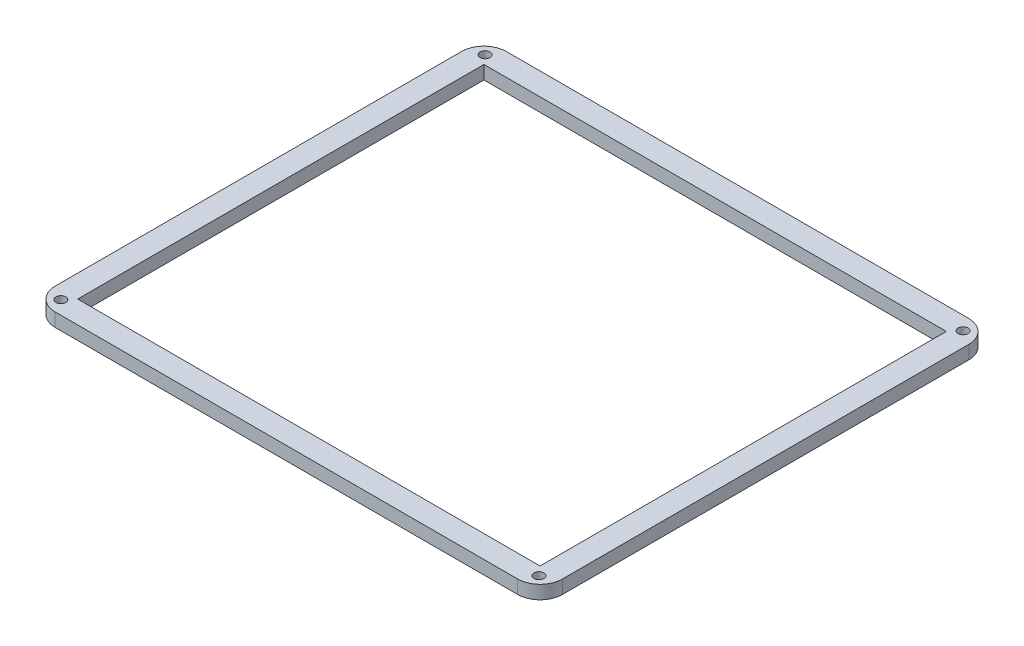
from build123d import *

# Parameters (mm, degrees)
SKETCH1_R           = 1.1
SKETCH1_W           = 103
SKETCH1_H           = 90.5
BOSS_EXTRUDE1_DEPTH = 3


with BuildPart() as part:
    # Sketch1 → Boss-Extrude1 (new body)
    with BuildSketch(Plane(origin=(0, 0, 0), x_dir=(1, 0, 0), z_dir=(0, 1, 0))):
        with BuildLine():
            Line((-51.5, -50.25), (51.5, -50.25))
            ThreePointArc((51.5, -50.25), (55.035533906, -48.785533906), (56.5, -45.25))
            Line((56.5, -45.25), (56.5, 45.25))
            ThreePointArc((56.5, 45.25), (55.035533906, 48.785533906), (51.5, 50.25))
            Line((51.5, 50.25), (-51.5, 50.25))
            ThreePointArc((-51.5, 50.25), (-55.035533906, 48.785533906), (-56.5, 45.25))
            Line((-56.5, 45.25), (-56.5, -45.25))
            ThreePointArc((-56.5, -45.25), (-55.035533906, -48.785533906), (-51.5, -50.25))
        make_face()
        with Locations(Location((-53.25, 47.25, 0), (0, 0, 270))):
            Circle(SKETCH1_R, mode=Mode.SUBTRACT)
        with Locations(Location((53.25, 47.25, 0), (0, 0, 270))):
            Circle(SKETCH1_R, mode=Mode.SUBTRACT)
        with Locations(Location((53.25, -47.25, 0), (0, 0, 90))):
            Circle(SKETCH1_R, mode=Mode.SUBTRACT)
        with Locations(Location((-53.25, -47.25, 0), (0, 0, 90))):
            Circle(SKETCH1_R, mode=Mode.SUBTRACT)
        Rectangle(SKETCH1_W, SKETCH1_H, mode=Mode.SUBTRACT)
    extrude(amount=BOSS_EXTRUDE1_DEPTH)


solid = part.part
